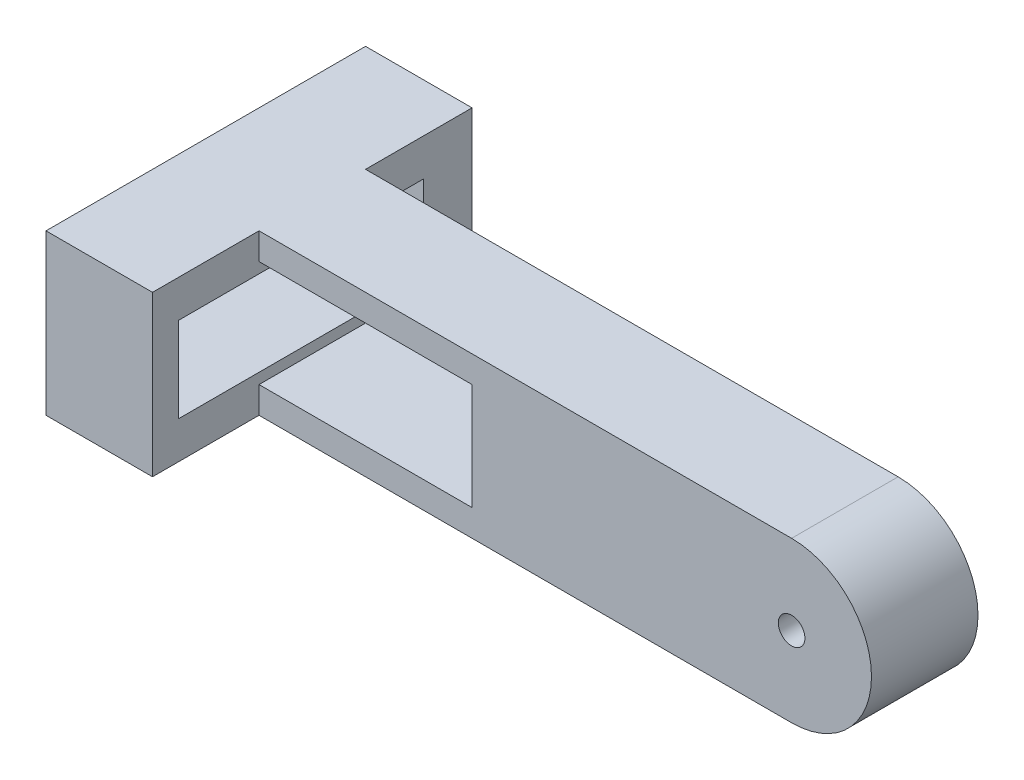
from build123d import *

# Parameters (mm, degrees)
SKETCH1_R           = 19.05
SKETCH1_W           = 152.4
SKETCH1_H           = 38.1
BOSS_EXTRUDE1_DEPTH = 25.4
SKETCH4_W           = 25.4
SKETCH4_H           = 38.1
BOSS_EXTRUDE3_DEPTH = 25.4
SKETCH6_W           = 25.4
SKETCH6_H           = 38.1
BOSS_EXTRUDE4_DEPTH = 25.4
SKETCH5_R           = 6.985
SKETCH5_R_2         = 1.905
CUT_EXTRUDE1_DEPTH  = 25.4
SKETCH7_W           = 50.8
SKETCH7_H           = 25.4
CUT_EXTRUDE2_DEPTH  = 25.4
SKETCH8_W           = 40.64
SKETCH8_H           = 20.32
CUT_EXTRUDE3_DEPTH  = 23.400004
SKETCH9_W           = 8.89
SKETCH9_H           = 20.32
CUT_EXTRUDE4_DEPTH  = 14.800072
SKETCH10_W          = 8.89
SKETCH10_H          = 2.54
CUT_EXTRUDE5_DEPTH  = 8.599932
SKETCH11_R          = 3.175
CUT_EXTRUDE6_DEPTH  = 110.617995785


with BuildPart() as part:
    # Sketch1 → Boss-Extrude1 (new body)
    with BuildSketch(Plane.XY):
        with Locations((76.2, 0)):
            Circle(SKETCH1_R)
        Rectangle(SKETCH1_W, SKETCH1_H)
    extrude(amount=BOSS_EXTRUDE1_DEPTH)

    # Sketch4 → Boss-Extrude3 (add)
    with BuildSketch(Plane.XY.offset(25.4)):
        with Locations((-63.5, 0)):
            Rectangle(SKETCH4_W, SKETCH4_H)
    extrude(amount=BOSS_EXTRUDE3_DEPTH)

    # Sketch6 → Boss-Extrude4 (add)
    with BuildSketch(Plane(origin=(0, 0, 0), x_dir=(-1, 0, 0), z_dir=(0, 0, -1))):
        with Locations((63.5, 0)):
            Rectangle(SKETCH6_W, SKETCH6_H)
    extrude(amount=BOSS_EXTRUDE4_DEPTH)

    # Sketch5 → Cut-Extrude1 (cut)
    with BuildSketch(Plane.ZY.offset(76.2)):
        with Locations((25.4, 0)):
            Circle(SKETCH5_R)
        with Locations((39.900098, 4.99999)):
            Circle(SKETCH5_R_2)
        with Locations((-9.099804, 4.99999)):
            Circle(SKETCH5_R_2)
        with Locations(Location((-9.099804, -4.99999, 0), (0, 0, 270))):
            Circle(SKETCH5_R_2)
        with Locations(Location((39.900098, -4.99999, 0), (0, 0, 270))):
            Circle(SKETCH5_R_2)
    extrude(amount=-CUT_EXTRUDE1_DEPTH, mode=Mode.SUBTRACT)

    # Sketch7 → Cut-Extrude2 (cut)
    with BuildSketch(Plane.XY.offset(25.4)):
        with Locations((-25.4, 0)):
            Rectangle(SKETCH7_W, SKETCH7_H)
    extrude(amount=-CUT_EXTRUDE2_DEPTH, mode=Mode.SUBTRACT)

    # Sketch8 → Cut-Extrude3 (cut)
    with BuildSketch(Plane(origin=(-50.8, 0, 0), x_dir=(0, 0, -1), z_dir=(1, 0, 0))):
        with Locations((-15.400147, 0)):
            Rectangle(SKETCH8_W, SKETCH8_H)
    extrude(amount=-CUT_EXTRUDE3_DEPTH, mode=Mode.SUBTRACT)

    # Sketch9 → Cut-Extrude4 (cut)
    with BuildSketch(Plane(origin=(-50.8, 0, 0), x_dir=(0, 0, -1), z_dir=(1, 0, 0))):
        with Locations((-40.165147, 0)):
            Rectangle(SKETCH9_W, SKETCH9_H)
        with Locations((9.364853, 0)):
            Rectangle(SKETCH9_W, SKETCH9_H)
    extrude(amount=-CUT_EXTRUDE4_DEPTH, mode=Mode.SUBTRACT)

    # Sketch10 → Cut-Extrude5 (cut)
    with BuildSketch(Plane(origin=(-65.600072, 0, 0), x_dir=(0, 0, -1), z_dir=(1, 0, 0))):
        with Locations((-40.165147, 0)):
            Rectangle(SKETCH10_W, SKETCH10_H)
        with Locations((9.364853, 0)):
            Rectangle(SKETCH10_W, SKETCH10_H)
    extrude(amount=-CUT_EXTRUDE5_DEPTH, mode=Mode.SUBTRACT)

    # Sketch11 → Cut-Extrude6 (cut, through all)
    with BuildSketch(Plane.XY.offset(25.4)):
        with Locations((76.2, 0)):
            Circle(SKETCH11_R)
    extrude(amount=-CUT_EXTRUDE6_DEPTH, mode=Mode.SUBTRACT)


solid = part.part
